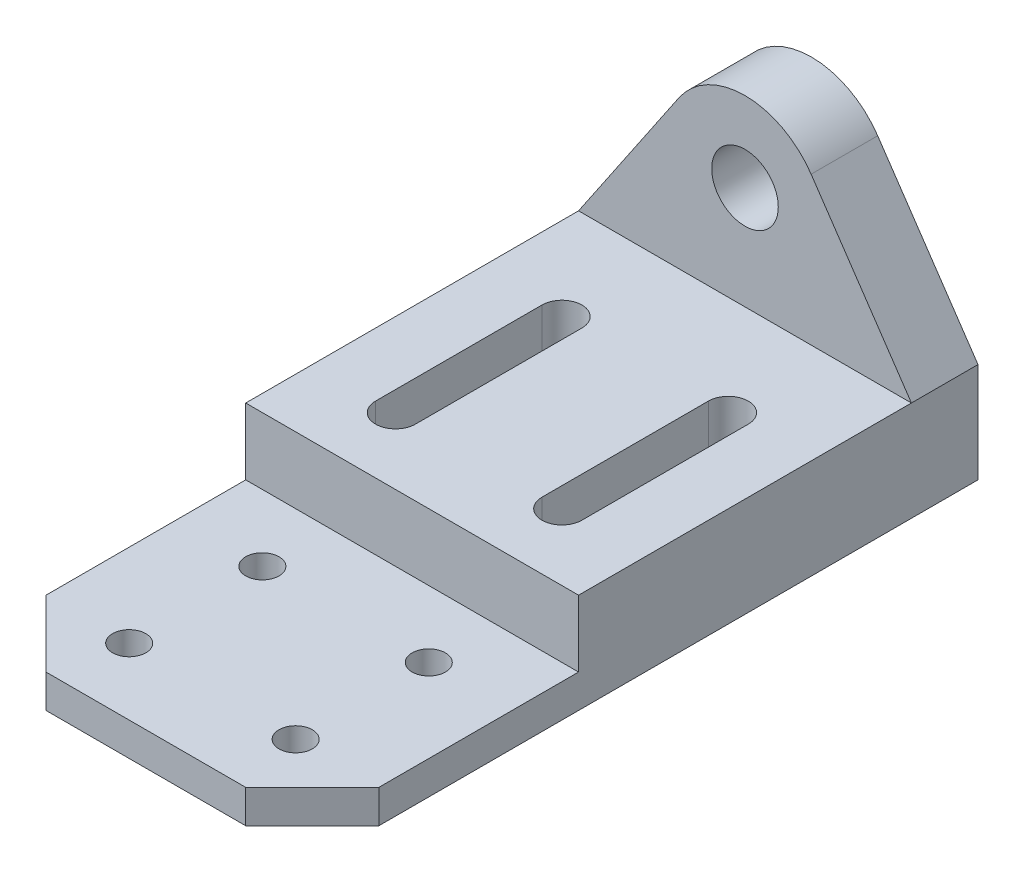
from build123d import *

# Parameters (mm, degrees)
BOSS_EXTRUDE1_DEPTH      = 50
BOSS_EXTRUDE1_DEPTH_BACK = 50
CHAMFER1_SIZE            = 20
HOLE1_D                  = 10
CUT_EXTRUDE1_DEPTH       = 125.599357944
SKETCH7_W                = 100
SKETCH7_H                = 55
CUT_EXTRUDE2_DEPTH       = 206.243757518
BOSS_EXTRUDE2_DEPTH      = 20
HOLE2_D                  = 20


with BuildPart() as part:
    # Sketch1 → Boss-Extrude1 (new, two sides: drawn at the far end of the back side and taken through both)
    with BuildSketch(Plane(origin=(0, 0, 0), x_dir=(0, 0, -1), z_dir=(1, 0, 0)).offset(-BOSS_EXTRUDE1_DEPTH_BACK)):
        Polygon((-100, 0), (100, 0), (100, 85), (80, 85), (80, 30), (-20, 30), (-20, 10), (-100, 10), align=None)
    extrude(amount=BOSS_EXTRUDE1_DEPTH + BOSS_EXTRUDE1_DEPTH_BACK)

    # Chamfer1
    chamfer1_edges = [part.edges().sort_by_distance(p)[0] for p in [
        (-50, 5, 100),
        (50, 5, 100),
    ]]
    chamfer(chamfer1_edges, length=CHAMFER1_SIZE)

    # Hole1 (through all)
    with Locations(Plane(origin=(0, 10, 0), x_dir=(1, 0, 0), z_dir=(0, 1, 0))):
        with Locations((-25, -40), (-25, -80)):
            hole1 = Hole(HOLE1_D / 2)

    # Mirror1: Hole1 across plane
    add(hole1.mirror(Plane(origin=(0, 0, 0), x_dir=(0, 0, 1), z_dir=(1, 0, 0))), mode=Mode.SUBTRACT)

    # Sketch4 → Cut-Extrude1 (cut, through all)
    with BuildSketch(Plane(origin=(0, 30, 0), x_dir=(1, 0, 0), z_dir=(0, 1, 0))):
        with BuildLine():
            Line((-19, 50), (-19, 0))
            ThreePointArc((-19, 0), (-25, -6), (-31, 0))
            Line((-31, 0), (-31, 50))
            ThreePointArc((-31, 50), (-25, 56), (-19, 50))
        make_face()
        with BuildLine():
            Line((19, 50), (19, 0))
            ThreePointArc((19, 0), (25, -6), (31, 0))
            Line((31, 0), (31, 50))
            ThreePointArc((31, 50), (25, 56), (19, 50))
        make_face()
    extrude(amount=-CUT_EXTRUDE1_DEPTH, mode=Mode.SUBTRACT)

    # Sketch7 → Cut-Extrude2 (cut, through all)
    with BuildSketch(Plane.XY.offset(-80)):
        with Locations((0, 57.5)):
            Rectangle(SKETCH7_W, SKETCH7_H)
    extrude(amount=-CUT_EXTRUDE2_DEPTH, mode=Mode.SUBTRACT)

    # Sketch8 → Boss-Extrude2 (add)
    with BuildSketch(Plane(origin=(0, 0, -100), x_dir=(-1, 0, 0), z_dir=(0, 0, -1))):
        with BuildLine():
            Line((50, 30), (-50, 30))
            Line((-50, 30), (-19.867631849, 74.463922337))
            ThreePointArc((-19.867631849, 74.463922337), (0, 85), (19.867631849, 74.463922337))
            Line((19.867631849, 74.463922337), (50, 30))
        make_face()
    extrude(amount=-BOSS_EXTRUDE2_DEPTH)

    # Hole2 (through all)
    with Locations(Plane.XY.offset(-80)):
        with Locations((0, 61)):
            Hole(HOLE2_D / 2)


solid = part.part
